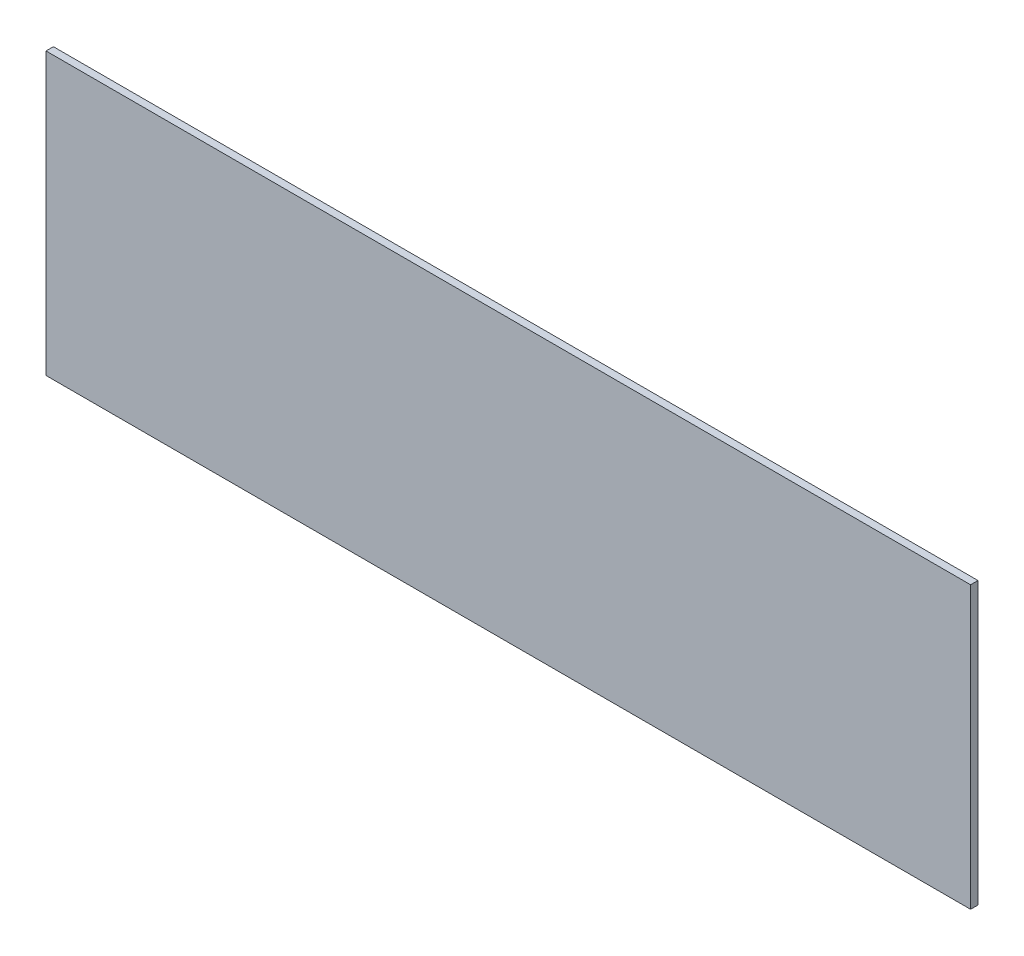
from build123d import *

# Parameters (mm, degrees)
SKETCH1_W     = 125
SKETCH1_H     = 38
PROFILE_DEPTH = 1


with BuildPart() as part:
    # Sketch1 → Profile (new body)
    with BuildSketch(Plane.XY):
        with Locations((62.5, 19)):
            Rectangle(SKETCH1_W, SKETCH1_H)
    extrude(amount=PROFILE_DEPTH)


solid = part.part
